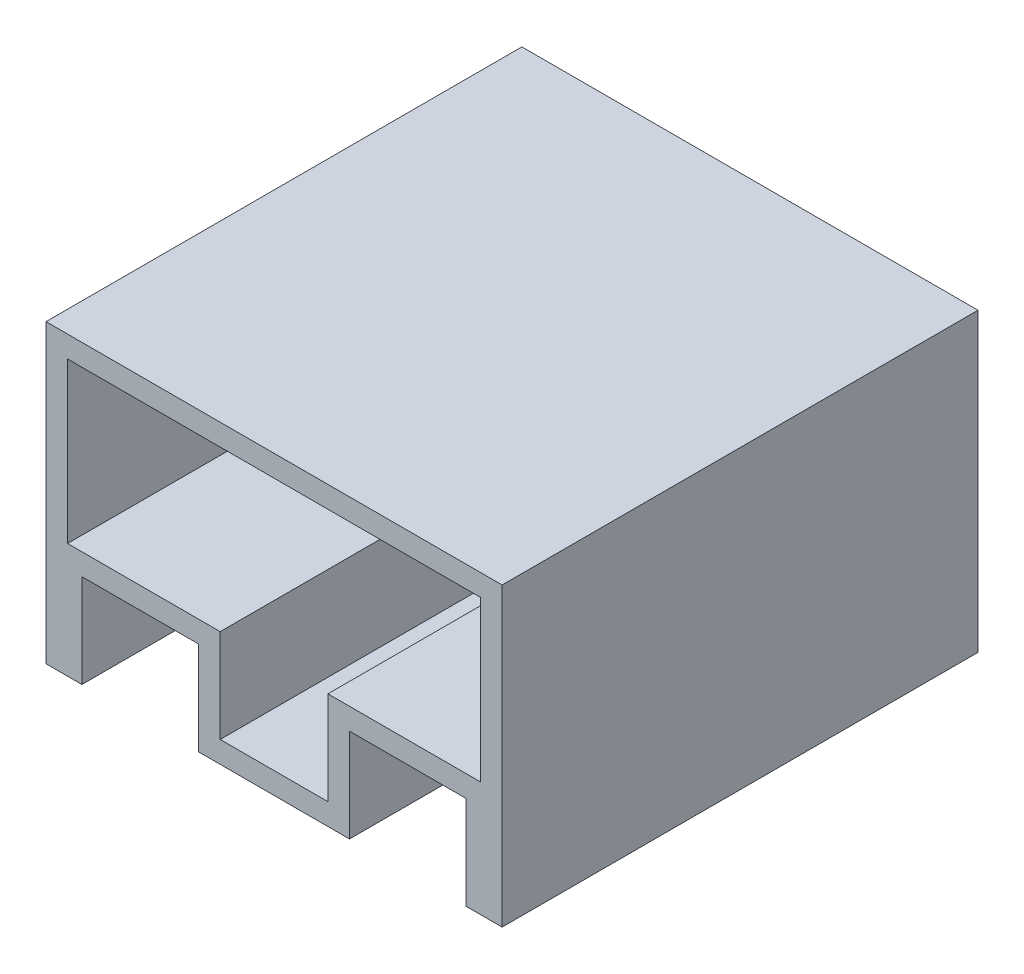
from build123d import *

# Parameters (mm, degrees)
EXTRUDE_1_DEPTH = 26.5
SKETCH_2_W      = 2
SKETCH_2_H      = 26.5
EXTRUDE_2_DEPTH = 5.2


with BuildPart() as part:
    # 草图1 → 凸台-拉伸1 (new body)
    with BuildSketch(Plane.XY):
        Polygon((-1.2, 1.2), (24.2, 1.2), (24.2, -10.1), (15.7, -10.1), (15.7, -15.3), (7.3, -15.3), (7.3, -10.1), (-1.2, -10.1), align=None)
        Polygon((0, 0), (23, 0), (23, -8.9), (14.5, -8.9), (14.5, -14.1), (8.5, -14.1), (8.5, -8.9), (0, -8.9), align=None, mode=Mode.SUBTRACT)
    extrude(amount=EXTRUDE_1_DEPTH)

    # 草图2 → 凸台-拉伸2 (add)
    with BuildSketch(Plane.XZ.offset(10.1)):
        with Locations((-0.2, 13.25)):
            Rectangle(SKETCH_2_W, SKETCH_2_H)
        with Locations((23.2, 13.25)):
            Rectangle(SKETCH_2_W, SKETCH_2_H)
    extrude(amount=EXTRUDE_2_DEPTH)


solid = part.part
